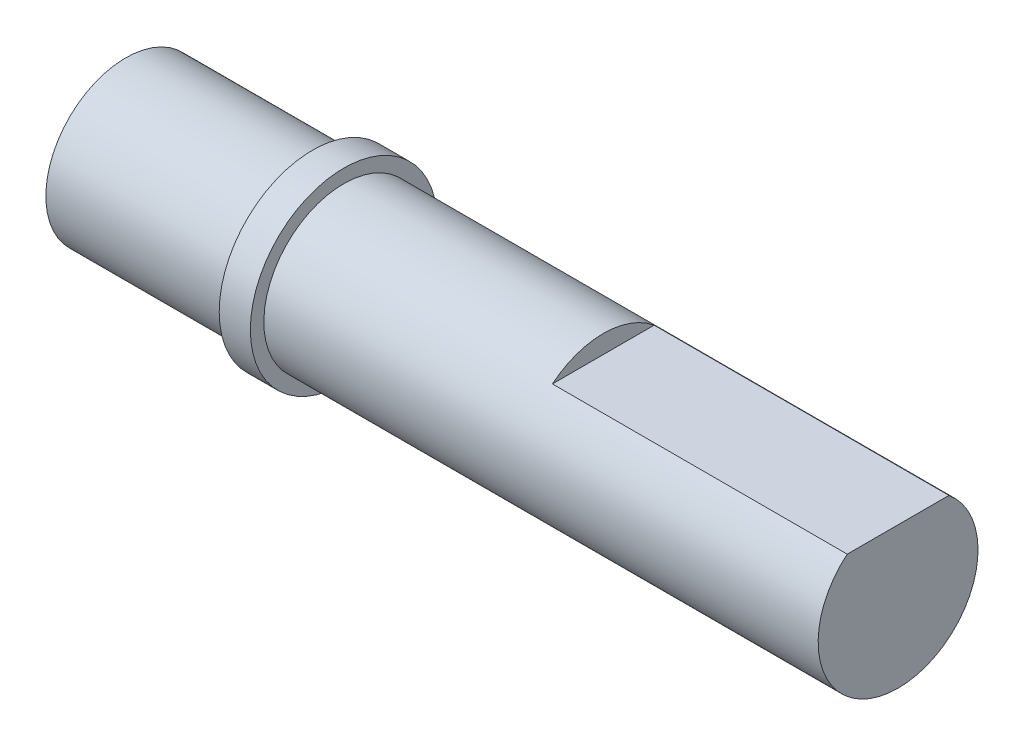
from build123d import *

# Parameters (mm, degrees)
BOSS_EXTRUDE1_DEPTH = 28.2
SKETCH9_6_R         = 4.5
BOSS_EXTRUDE2_DEPTH = 1.5
BOSS_EXTRUDE3_DEPTH = 14
BOSS_EXTRUDE4_START = -9
SKETCH9_8_R         = 3.85
BOSS_EXTRUDE4_DEPTH = 9


with BuildPart() as part:
    # Sketch9 → Boss-Extrude1 (new body)
    with BuildSketch(Plane(origin=(0, 0, 0), x_dir=(0, 0, -1), z_dir=(1, 0, 0))):
        with BuildLine():
            Line((2.45, 2.969848481), (-2.45, 2.969848481))
            ThreePointArc((-2.45, 2.969848481), (-1.641645516, -3.48245603), (3.85, 0))
            ThreePointArc((3.85, 0), (3.48245603, 1.641645516), (2.45, 2.969848481))
        make_face()
    extrude(amount=BOSS_EXTRUDE1_DEPTH)

    # Sketch9<6> → Boss-Extrude2 (add)
    with BuildSketch(Plane(origin=(0, 0, 0), x_dir=(0, 0, -1), z_dir=(1, 0, 0))):
        Circle(SKETCH9_6_R)
        with BuildLine():
            ThreePointArc((3.85, 0), (-1.641645516, -3.48245603), (-2.45, 2.969848481))
            ThreePointArc((-2.45, 2.969848481), (0, 3.85), (2.45, 2.969848481))
            ThreePointArc((2.45, 2.969848481), (3.48245603, 1.641645516), (3.85, 0))
        make_face(mode=Mode.SUBTRACT)
    extrude(amount=BOSS_EXTRUDE2_DEPTH)

    # Sketch9<7> → Boss-Extrude3 (add)
    with BuildSketch(Plane(origin=(0, 0, 0), x_dir=(0, 0, -1), z_dir=(1, 0, 0))):
        with BuildLine():
            ThreePointArc((2.45, 2.969848481), (0, 3.85), (-2.45, 2.969848481))
            Line((-2.45, 2.969848481), (2.45, 2.969848481))
        make_face()
    extrude(amount=BOSS_EXTRUDE3_DEPTH)

    # Sketch9<8> → Boss-Extrude4 (add)
    with BuildSketch(Plane(origin=(0, 0, 0), x_dir=(0, 0, -1), z_dir=(1, 0, 0)).offset(BOSS_EXTRUDE4_START)):
        Circle(SKETCH9_8_R)
    extrude(amount=BOSS_EXTRUDE4_DEPTH)


solid = part.part
